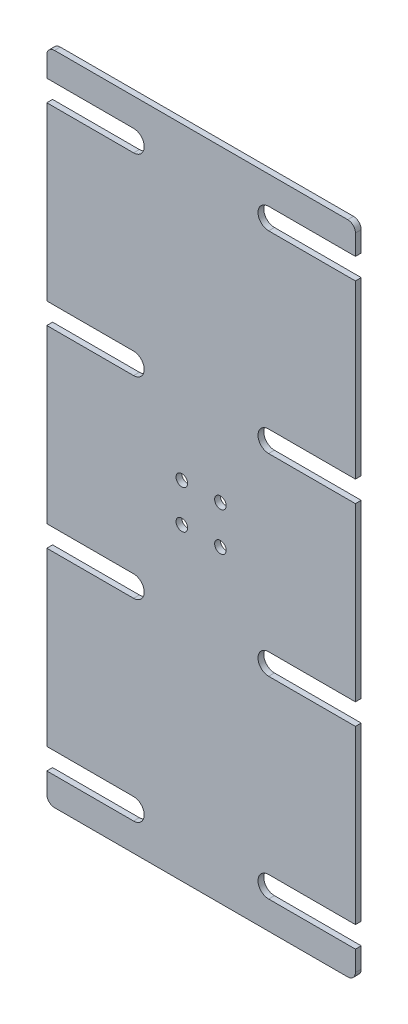
from build123d import *

# Parameters (mm, degrees)
EXTRUDE_1_DEPTH      = 1.5
CUT_EXTRUDE_1_DEPTH  = 1.5
SKETCH_3_R           = 2
CUT_EXTRUDE_2_DEPTH  = 1.5
SKETCH_4_W           = 80
SKETCH_4_H           = 5
EXTRUDE_2_DEPTH      = 1.5
FILLET_1_R           = 2
SKETCH_5_OUTSIDE_W   = 163.618
SKETCH_5_OUTSIDE_H   = 213.618
SKETCH_5_OUTSIDE_W_2 = 80
SKETCH_5_OUTSIDE_H_2 = 170
CUT_EXTRUDE_3_DEPTH  = 193.943644622
SKETCH_6_R           = 1.5
CUT_EXTRUDE_4_DEPTH  = 184.377343202


with BuildPart() as part:
    # 草图1 → 凸台-拉伸1 (new body)
    with BuildSketch(Plane.XY):
        Polygon((80, 90), (100, 90), (100, 70), (80, 70), (80, 0), (0, 0), (0, 70), (-20, 70), (-20, 90), (0, 90), (0, 160), (80, 160), align=None)
    extrude(amount=EXTRUDE_1_DEPTH)

    # 草图2 → 切除-拉伸1 (cut)
    with BuildSketch(Plane.XY.offset(1.5)):
        with BuildLine():
            Line((57.5, 152.25), (80, 152.25))
            Line((80, 152.25), (80, 157.75))
            Line((80, 157.75), (57.5, 157.75))
            ThreePointArc((57.5, 157.75), (54.75, 155), (57.5, 152.25))
        make_face()
        with BuildLine():
            Line((22.5, 152.25), (0, 152.25))
            Line((0, 152.25), (0, 157.75))
            Line((0, 157.75), (22.5, 157.75))
            ThreePointArc((22.5, 157.75), (25.25, 155), (22.5, 152.25))
        make_face()
        with BuildLine():
            Line((57.5, 102.25), (80, 102.25))
            Line((80, 102.25), (80, 107.75))
            Line((80, 107.75), (57.5, 107.75))
            ThreePointArc((57.5, 107.75), (54.75, 105), (57.5, 102.25))
        make_face()
        with BuildLine():
            Line((22.5, 107.75), (0, 107.75))
            Line((0, 107.75), (0, 102.25))
            Line((0, 102.25), (22.5, 102.25))
            ThreePointArc((22.5, 102.25), (25.25, 105), (22.5, 107.75))
        make_face()
        with BuildLine():
            Line((22.5, 57.75), (0, 57.75))
            Line((0, 57.75), (0, 52.25))
            Line((0, 52.25), (22.5, 52.25))
            ThreePointArc((22.5, 52.25), (25.25, 55), (22.5, 57.75))
        make_face()
        with BuildLine():
            Line((57.5, 52.25), (80, 52.25))
            Line((80, 52.25), (80, 57.75))
            Line((80, 57.75), (57.5, 57.75))
            ThreePointArc((57.5, 57.75), (54.75, 55), (57.5, 52.25))
        make_face()
        with BuildLine():
            Line((22.5, 7.75), (0, 7.75))
            Line((0, 7.75), (0, 2.25))
            Line((0, 2.25), (22.5, 2.25))
            ThreePointArc((22.5, 2.25), (25.25, 5), (22.5, 7.75))
        make_face()
        with BuildLine():
            Line((57.5, 7.75), (80, 7.75))
            Line((80, 7.75), (80, 2.25))
            Line((80, 2.25), (57.5, 2.25))
            ThreePointArc((57.5, 2.25), (54.75, 5), (57.5, 7.75))
        make_face()
    extrude(amount=-CUT_EXTRUDE_1_DEPTH, mode=Mode.SUBTRACT)

    # 草图3 → 切除-拉伸2 (cut)
    with BuildSketch(Plane.XY.offset(1.5)):
        with Locations((90, 80)):
            Circle(SKETCH_3_R)
        with Locations((-10, 80)):
            Circle(SKETCH_3_R)
    extrude(amount=-CUT_EXTRUDE_2_DEPTH, mode=Mode.SUBTRACT)

    # 草图4 → 凸台-拉伸2 (add)
    with BuildSketch(Plane(origin=(0, 0, 0), x_dir=(-1, 0, 0), z_dir=(0, 0, -1))):
        with Locations((-40, 162.5)):
            Rectangle(SKETCH_4_W, SKETCH_4_H)
        with Locations((-40, -2.5)):
            Rectangle(SKETCH_4_W, SKETCH_4_H)
    extrude(amount=-EXTRUDE_2_DEPTH)

    # 圆角1
    fillet_1_edges = [part.edges().sort_by_distance(p)[0] for p in [
        (0, 165, 0.75),
        (80, 165, 0.75),
        (0, -5, 0.75),
        (80, -5, 0.75),
    ]]
    fillet(fillet_1_edges, radius=FILLET_1_R)

    # 草图5 outside → 切除-拉伸3 (cut, through all)
    with BuildSketch(Plane.XY.offset(1.5)):
        with Locations((40, 80)):
            Rectangle(SKETCH_5_OUTSIDE_W, SKETCH_5_OUTSIDE_H)
        with Locations((40, 80)):
            Rectangle(SKETCH_5_OUTSIDE_W_2, SKETCH_5_OUTSIDE_H_2, mode=Mode.SUBTRACT)
    extrude(amount=-CUT_EXTRUDE_3_DEPTH, mode=Mode.SUBTRACT)

    # 草图6 → 切除-拉伸4 (cut, through all)
    with BuildSketch(Plane(origin=(0, 0, 0), x_dir=(-1, 0, 0), z_dir=(0, 0, -1))):
        with Locations((-35, 85)):
            Circle(SKETCH_6_R)
        with Locations((-35, 75)):
            Circle(SKETCH_6_R)
        with Locations(Location((-45, 75, 0), (0, 0, 180))):
            Circle(SKETCH_6_R)
        with Locations(Location((-45, 85, 0), (0, 0, 180))):
            Circle(SKETCH_6_R)
    extrude(amount=-CUT_EXTRUDE_4_DEPTH, mode=Mode.SUBTRACT)


solid = part.part
